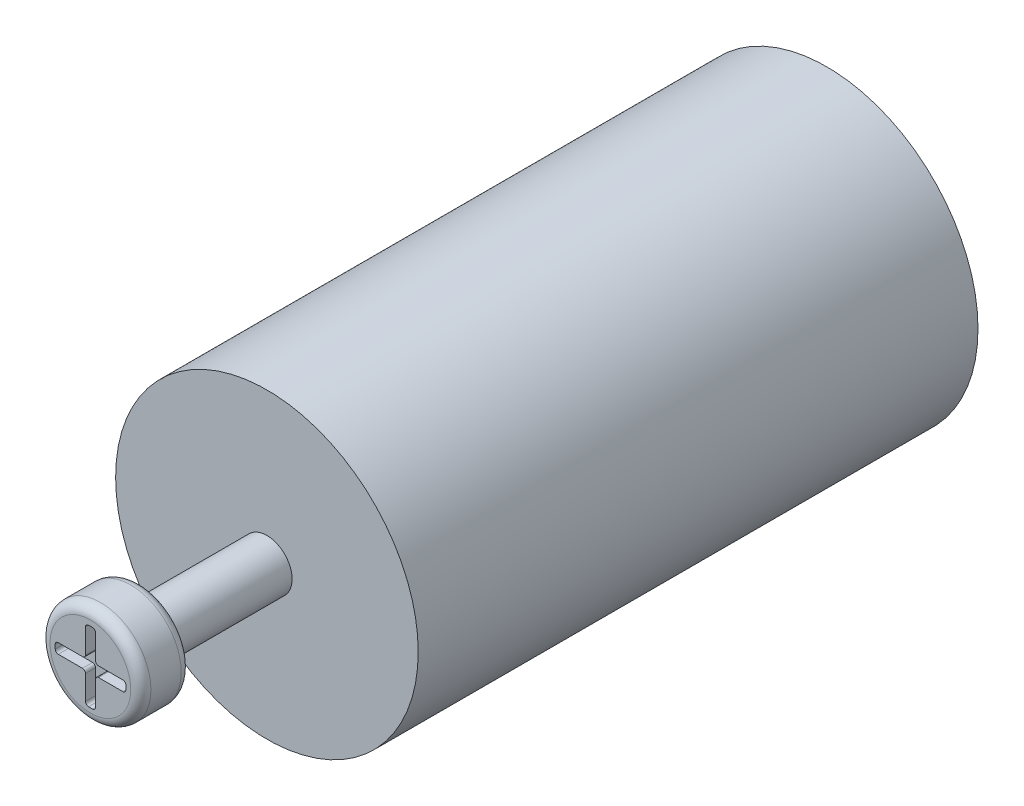
from build123d import *

# Parameters (mm, degrees)
SKETCH1_R           = 6.35
BOSS_EXTRUDE1_DEPTH = 6.35
SKETCH2_R           = 38.1
BOSS_EXTRUDE2_DEPTH = 140.97
SKETCH3_R           = 6.35
BOSS_EXTRUDE3_DEPTH = 31.75
SKETCH4_R           = 12.7
BOSS_EXTRUDE4_DEPTH = 12.7
FILLET1_R           = 2.54
CUT_EXTRUDE1_DEPTH  = 2.54


with BuildPart() as part:
    # Sketch1 → Boss-Extrude1 (new body)
    with BuildSketch(Plane.XY):
        Circle(SKETCH1_R)
    extrude(amount=BOSS_EXTRUDE1_DEPTH)

    # Sketch2 → Boss-Extrude2 (add)
    with BuildSketch(Plane.XY.offset(6.35)):
        Circle(SKETCH2_R)
    extrude(amount=BOSS_EXTRUDE2_DEPTH)

    # Sketch3 → Boss-Extrude3 (add)
    with BuildSketch(Plane.XY.offset(147.32)):
        Circle(SKETCH3_R)
    extrude(amount=BOSS_EXTRUDE3_DEPTH)

    # Sketch4 → Boss-Extrude4 (add)
    with BuildSketch(Plane.XY.offset(179.07)):
        Circle(SKETCH4_R)
    extrude(amount=BOSS_EXTRUDE4_DEPTH)

    # Fillet1
    fillet1_edges = [part.edges().sort_by_distance(p)[0] for p in [
        (-6.35, 0, 179.07),
        (-12.7, 0, 179.07),
        (-12.7, 0, 191.77),
    ]]
    fillet(fillet1_edges, radius=FILLET1_R)

    # Sketch5 → Cut-Extrude1 (cut)
    with BuildSketch(Plane.XY.offset(191.77)):
        with BuildLine():
            Line((-0.475346185, 8.776619382), (0.540653815, 8.776619382))
            ThreePointArc((0.540653815, 8.776619382), (1.079469182, 8.55343475), (1.302653815, 8.014619382))
            Line((1.302653815, 8.014619382), (1.302653815, 1.918619382))
            ThreePointArc((1.302653815, 1.918619382), (1.525838448, 1.379804015), (2.064653815, 1.156619382))
            Line((2.064653815, 1.156619382), (8.160653815, 1.156619382))
            ThreePointArc((8.160653815, 1.156619382), (8.699469182, 0.93343475), (8.922653815, 0.394619382))
            Line((8.922653815, 0.394619382), (8.922653815, -0.621380618))
            ThreePointArc((8.922653815, -0.621380618), (8.699469182, -1.160195985), (8.160653815, -1.383380618))
            Line((8.160653815, -1.383380618), (2.064653815, -1.383380618))
            ThreePointArc((2.064653815, -1.383380618), (1.525838448, -1.60656525), (1.302653815, -2.145380618))
            Line((1.302653815, -2.145380618), (1.302653815, -8.241380618))
            ThreePointArc((1.302653815, -8.241380618), (1.079469182, -8.780195985), (0.540653815, -9.003380618))
            Line((0.540653815, -9.003380618), (-0.475346185, -9.003380618))
            ThreePointArc((-0.475346185, -9.003380618), (-1.014161552, -8.780195985), (-1.237346185, -8.241380618))
            Line((-1.237346185, -8.241380618), (-1.237346185, -2.145380618))
            ThreePointArc((-1.237346185, -2.145380618), (-1.460530818, -1.60656525), (-1.999346185, -1.383380618))
            Line((-1.999346185, -1.383380618), (-8.095346185, -1.383380618))
            ThreePointArc((-8.095346185, -1.383380618), (-8.634161552, -1.160195985), (-8.857346185, -0.621380618))
            Line((-8.857346185, -0.621380618), (-8.857346185, 0.394619382))
            ThreePointArc((-8.857346185, 0.394619382), (-8.634161552, 0.93343475), (-8.095346185, 1.156619382))
            Line((-8.095346185, 1.156619382), (-1.999346185, 1.156619382))
            ThreePointArc((-1.999346185, 1.156619382), (-1.460530818, 1.379804015), (-1.237346185, 1.918619382))
            Line((-1.237346185, 1.918619382), (-1.237346185, 8.014619382))
            ThreePointArc((-1.237346185, 8.014619382), (-1.014161552, 8.55343475), (-0.475346185, 8.776619382))
        make_face()
    extrude(amount=-CUT_EXTRUDE1_DEPTH, mode=Mode.SUBTRACT)


solid = part.part
